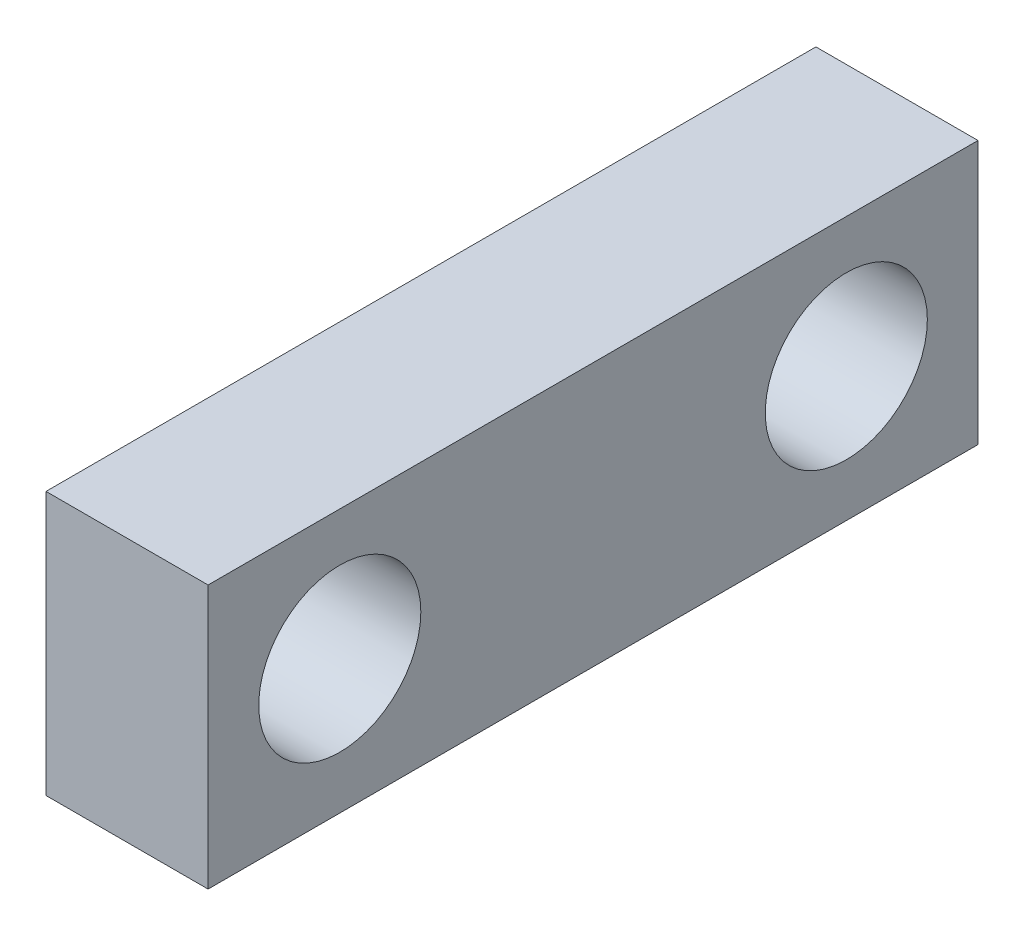
from build123d import *

# Parameters (mm, degrees)
SKETCH1_W           = 38
SKETCH1_H           = 13
SKETCH1_R           = 4
BOSS_EXTRUDE1_DEPTH = 8


with BuildPart() as part:
    # Sketch1 → Boss-Extrude1 (new body)
    with BuildSketch(Plane(origin=(0, 0, 0), x_dir=(0, 0, -1), z_dir=(1, 0, 0))):
        with Locations((-465.406543956, 47.44372232)):
            Rectangle(SKETCH1_W, SKETCH1_H)
        with Locations((-477.906543956, 47.54372232)):
            Circle(SKETCH1_R, mode=Mode.SUBTRACT)
        with Locations((-452.906543956, 47.54372232)):
            Circle(SKETCH1_R, mode=Mode.SUBTRACT)
    extrude(amount=BOSS_EXTRUDE1_DEPTH)


solid = part.part
